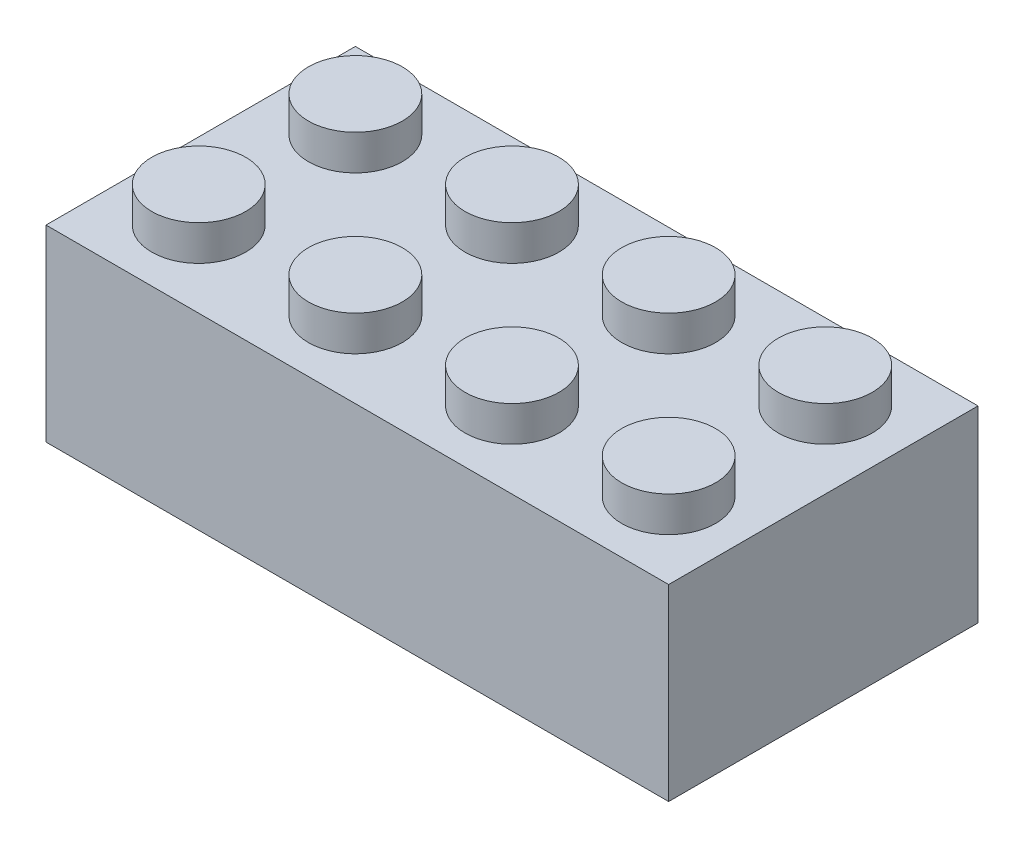
from build123d import *

# Parameters (mm, degrees)
SKETCH1_W                 = 31.8
SKETCH1_H                 = 15.8
BOSS_EXTRUDE1_DEPTH       = 9.6
SKETCH2_R                 = 2.4
BOSS_EXTRUDE2_DEPTH       = 1.8
SKETCH3_W                 = 29.4
SKETCH3_H                 = 13.4
CUT_EXTRUDE1_DEPTH        = 8.6
SKETCH4_R                 = 1.3
CUT_EXTRUDE2_DEPTH        = 1.7
SKETCH5_R                 = 3.11
SKETCH5_R_2               = 2.4
BOSS_EXTRUDE3_DEPTH       = 8.6
BOSS_EXTRUDE4_DEPTH       = 6.3
SKETCH7_W                 = 0.6
SKETCH7_H                 = 0.2
SKETCH7_W_2               = 0.2
SKETCH7_H_2               = 0.6
BOSS_EXTRUDE5_DEPTH       = 8.6
MIRROR2_COPY_1_SKETCH_W   = 0.6
MIRROR2_COPY_1_SKETCH_H   = 0.2
MIRROR2_COPY_1_SKETCH_W_2 = 0.2
MIRROR2_COPY_1_SKETCH_H_2 = 0.6
MIRROR2_COPY_1_DEPTH      = 8.6


with BuildPart() as part:
    # Sketch1 → Boss-Extrude1 (new body)
    with BuildSketch(Plane(origin=(0, 0, 0), x_dir=(1, 0, 0), z_dir=(0, 1, 0))):
        Rectangle(SKETCH1_W, SKETCH1_H)
    extrude(amount=-BOSS_EXTRUDE1_DEPTH)

    # Sketch2 → Boss-Extrude2 (add)
    with BuildSketch(Plane(origin=(0, 0, 0), x_dir=(1, 0, 0), z_dir=(0, 1, 0))):
        with Locations(Location((-12, 4, 0), (0, 0, 270))):
            Circle(SKETCH2_R)
        with Locations(Location((-4, 4, 0), (0, 0, 270))):
            Circle(SKETCH2_R)
        with Locations(Location((4, 4, 0), (0, 0, 270))):
            Circle(SKETCH2_R)
        with Locations(Location((12, 4, 0), (0, 0, 270))):
            Circle(SKETCH2_R)
        with Locations(Location((12, -4, 0), (0, 0, 270))):
            Circle(SKETCH2_R)
        with Locations(Location((4, -4, 0), (0, 0, 270))):
            Circle(SKETCH2_R)
        with Locations(Location((-4, -4, 0), (0, 0, 270))):
            Circle(SKETCH2_R)
        with Locations(Location((-12, -4, 0), (0, 0, 270))):
            Circle(SKETCH2_R)
    extrude(amount=BOSS_EXTRUDE2_DEPTH)

    # Sketch3 → Cut-Extrude1 (cut)
    with BuildSketch(Plane.XZ.offset(9.6)):
        Rectangle(SKETCH3_W, SKETCH3_H)
    extrude(amount=-CUT_EXTRUDE1_DEPTH, mode=Mode.SUBTRACT)

    # Sketch4 → Cut-Extrude2 (cut)
    with BuildSketch(Plane.XZ.offset(1)):
        with Locations(Location((-12, 4, 0), (0, 0, 270))):
            Circle(SKETCH4_R)
        with Locations(Location((-4, 4, 0), (0, 0, 270))):
            Circle(SKETCH4_R)
        with Locations(Location((4, 4, 0), (0, 0, 270))):
            Circle(SKETCH4_R)
        with Locations(Location((12, 4, 0), (0, 0, 270))):
            Circle(SKETCH4_R)
        with Locations(Location((12, -4, 0), (0, 0, 270))):
            Circle(SKETCH4_R)
        with Locations(Location((4, -4, 0), (0, 0, 270))):
            Circle(SKETCH4_R)
        with Locations(Location((-4, -4, 0), (0, 0, 270))):
            Circle(SKETCH4_R)
        with Locations(Location((-12, -4, 0), (0, 0, 270))):
            Circle(SKETCH4_R)
    extrude(amount=-CUT_EXTRUDE2_DEPTH, mode=Mode.SUBTRACT)

    # Sketch5 → Boss-Extrude3 (add)
    # profile 1 of 3: a face of its own
    with BuildSketch(Plane.XZ.offset(1)):
        with Locations(Location((-8, 0, 0), (0, 0, 90))):
            Circle(SKETCH5_R)
        with Locations(Location((-8, 0, 0), (0, 0, 90))):
            Circle(SKETCH5_R_2, mode=Mode.SUBTRACT)
    # profile 2 of 3: a face of its own
    with BuildSketch(Plane.XZ.offset(1)):
        with Locations(Location((0, 0, 0), (0, 0, 90))):
            Circle(SKETCH5_R)
        with Locations(Location((0, 0, 0), (0, 0, 90))):
            Circle(SKETCH5_R_2, mode=Mode.SUBTRACT)
    # profile 3 of 3: a face of its own
    with BuildSketch(Plane.XZ.offset(1)):
        with Locations(Location((8, 0, 0), (0, 0, 90))):
            Circle(SKETCH5_R)
        with Locations(Location((8, 0, 0), (0, 0, 90))):
            Circle(SKETCH5_R_2, mode=Mode.SUBTRACT)
    extrude(amount=BOSS_EXTRUDE3_DEPTH)

    # Sketch6 → Boss-Extrude4 (add)
    with BuildSketch(Plane.XZ.offset(1)):
        with BuildLine():
            Line((-0.4, 6.7), (-0.4, 3.084169256))
            ThreePointArc((-0.4, 3.084169256), (0, 3.11), (0.4, 3.084169256))
            Line((0.4, 3.084169256), (0.4, 6.7))
            Line((0.4, 6.7), (-0.4, 6.7))
        make_face()
        with BuildLine():
            Line((-0.4, -3.084169256), (-0.4, -6.7))
            Line((-0.4, -6.7), (0.4, -6.7))
            Line((0.4, -6.7), (0.4, -3.084169256))
            ThreePointArc((0.4, -3.084169256), (0, -3.11), (-0.4, -3.084169256))
        make_face()
    extrude(amount=BOSS_EXTRUDE4_DEPTH)

    # Sketch7 → Boss-Extrude5 (add)
    with BuildSketch(Plane.XZ.offset(1)):
        with Locations((-12, 6.6)):
            Rectangle(SKETCH7_W, SKETCH7_H)
        with Locations((-4, 6.6)):
            Rectangle(SKETCH7_W, SKETCH7_H)
        with Locations((-14.6, 4)):
            Rectangle(SKETCH7_W_2, SKETCH7_H_2)
    boss_extrude5 = extrude(amount=BOSS_EXTRUDE5_DEPTH)

    # Mirror1: Boss-Extrude5 across plane
    add(boss_extrude5.mirror(Plane(origin=(0, 0, 0), x_dir=(0, 0, 1), z_dir=(1, 0, 0))))

    # Mirror2: Boss-Extrude5 across plane
    add(boss_extrude5.mirror(Plane.XY))

    # Mirror2 copy 1 sketch → Mirror2 copy 1 (add)
    with BuildSketch(Plane(origin=(0, -1, 0), x_dir=(-1, 0, 0), z_dir=(0, -1, 0))):
        with Locations((-12, 6.6)):
            Rectangle(MIRROR2_COPY_1_SKETCH_W, MIRROR2_COPY_1_SKETCH_H)
        with Locations((-4, 6.6)):
            Rectangle(MIRROR2_COPY_1_SKETCH_W, MIRROR2_COPY_1_SKETCH_H)
        with Locations((-14.6, 4)):
            Rectangle(MIRROR2_COPY_1_SKETCH_W_2, MIRROR2_COPY_1_SKETCH_H_2)
    extrude(amount=MIRROR2_COPY_1_DEPTH)


solid = part.part
